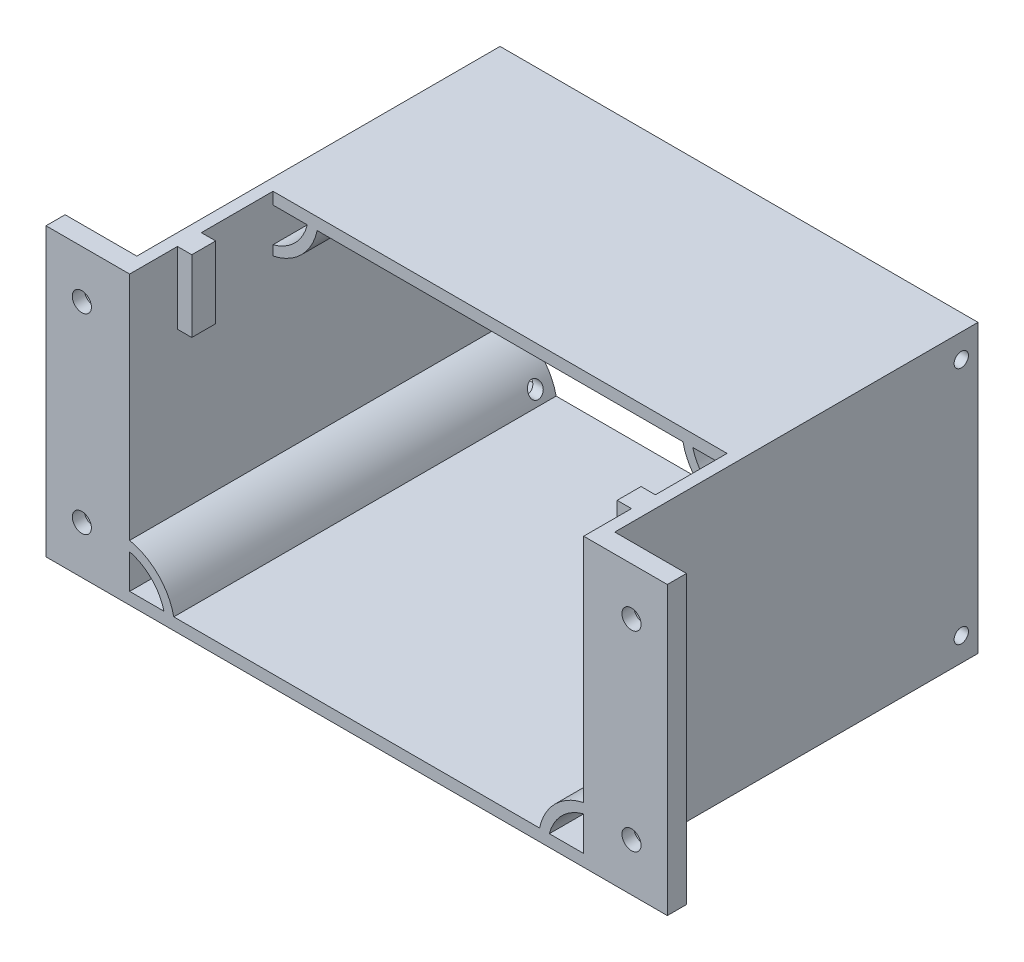
from build123d import *

# Parameters (mm, degrees)
SKETCH1_W                = 100
SKETCH1_H                = 60
BOSS_EXTRUDE1_DEPTH      = 150
SKETCH2_W                = 95
SKETCH2_H                = 30
CUT_EXTRUDE1_DEPTH       = 20
BOSS_EXTRUDE2_DEPTH      = 13
BOSS_EXTRUDE2_DEPTH_BACK = 5
SKETCH3_W                = 106
SKETCH3_H                = 66
SKETCH3_W_2              = 100
SKETCH3_H_2              = 60
SKETCH4_R                = 1.5
CUT_EXTRUDE2_DEPTH       = 120
SKETCH5_R                = 3
CUT_EXTRUDE3_DEPTH       = 1
CUT_EXTRUDE4_START       = -1
SKETCH6_R                = 3
CUT_EXTRUDE4_DEPTH       = 1
SKETCH8_W                = 157.221191822
SKETCH8_H                = 99.5531871
CUT_EXTRUDE6_DEPTH       = 83
SKETCH9_R                = 1.5
CUT_EXTRUDE7_DEPTH       = 120
SKETCH10_W               = 3
SKETCH10_H               = 5
BOSS_EXTRUDE3_DEPTH      = 15
SKETCH11_W               = 15
SKETCH11_H               = 60
SKETCH11_R               = 3
BOSS_EXTRUDE4_DEPTH      = 4
SKETCH11_3_R             = 3
SKETCH11_3_R_2           = 2
BOSS_EXTRUDE5_DEPTH      = 2.5


with BuildPart() as part:
    # Sketch1 → Boss-Extrude1 (new body)
    with BuildSketch(Plane.XY):
        with Locations((9.751655629, 0.960264901)):
            Rectangle(SKETCH1_W, SKETCH1_H)
        with BuildLine():
            Line((-37.748344371, 21.277806535), (-37.748344371, 28.460264901))
            Line((-37.748344371, 28.460264901), (-30.565886005, 28.460264901))
            ThreePointArc((-30.565886005, 28.460264901), (-33.177276559, 23.889197089), (-37.748344371, 21.277806535))
        make_face(mode=Mode.SUBTRACT)
        with BuildLine():
            Line((-37.748344371, -17.303040505), (-37.748344371, 19.223570306))
            ThreePointArc((-37.748344371, 19.223570306), (-31.763062997, 22.474983526), (-28.511649777, 28.460264901))
            Line((-28.511649777, 28.460264901), (48.014961035, 28.460264901))
            ThreePointArc((48.014961035, 28.460264901), (51.266374255, 22.474983526), (57.251655629, 19.223570306))
            Line((57.251655629, 19.223570306), (57.251655629, -17.303040505))
            ThreePointArc((57.251655629, -17.303040505), (51.266374255, -20.554453725), (48.014961035, -26.539735099))
            Line((48.014961035, -26.539735099), (-28.511649777, -26.539735099))
            ThreePointArc((-28.511649777, -26.539735099), (-31.763062997, -20.554453725), (-37.748344371, -17.303040505))
        make_face(mode=Mode.SUBTRACT)
        with BuildLine():
            Line((-37.748344371, -26.539735099), (-37.748344371, -19.357276734))
            ThreePointArc((-37.748344371, -19.357276734), (-33.177276559, -21.968667287), (-30.565886005, -26.539735099))
            Line((-30.565886005, -26.539735099), (-37.748344371, -26.539735099))
        make_face(mode=Mode.SUBTRACT)
        with BuildLine():
            Line((57.251655629, -26.539735099), (50.069197264, -26.539735099))
            ThreePointArc((50.069197264, -26.539735099), (52.680587817, -21.968667287), (57.251655629, -19.357276734))
            Line((57.251655629, -19.357276734), (57.251655629, -26.539735099))
        make_face(mode=Mode.SUBTRACT)
        with BuildLine():
            Line((57.251655629, 28.460264901), (57.251655629, 21.277806535))
            ThreePointArc((57.251655629, 21.277806535), (52.680587817, 23.889197089), (50.069197264, 28.460264901))
            Line((50.069197264, 28.460264901), (57.251655629, 28.460264901))
        make_face(mode=Mode.SUBTRACT)
    extrude(amount=BOSS_EXTRUDE1_DEPTH)

    # Sketch2 → Cut-Extrude1 (cut)
    with BuildSketch(Plane(origin=(0, 30.960264901, 0), x_dir=(1, 0, 0), z_dir=(0, 1, 0))):
        with Locations((9.751655629, -135)):
            Rectangle(SKETCH2_W, SKETCH2_H)
    extrude(amount=-CUT_EXTRUDE1_DEPTH, mode=Mode.SUBTRACT)

    # Sketch3 → Boss-Extrude2 (add, two sides: drawn at the far end of the back side and taken through both)
    with BuildSketch(Plane(origin=(0, 0, 0), x_dir=(-1, 0, 0), z_dir=(0, 0, -1)).offset(-BOSS_EXTRUDE2_DEPTH_BACK)):
        with Locations((-9.751655629, 0.960264901)):
            Rectangle(SKETCH3_W, SKETCH3_H)
        with Locations((-9.751655629, 0.960264901)):
            Rectangle(SKETCH3_W_2, SKETCH3_H_2, mode=Mode.SUBTRACT)
    extrude(amount=BOSS_EXTRUDE2_DEPTH + BOSS_EXTRUDE2_DEPTH_BACK)

    # Sketch4 → Cut-Extrude2 (cut)
    with BuildSketch(Plane.ZY.offset(43.248344371)):
        with Locations((-4, -24.039735099)):
            Circle(SKETCH4_R)
        with Locations((-4, 25.960264901)):
            Circle(SKETCH4_R)
    extrude(amount=-CUT_EXTRUDE2_DEPTH, mode=Mode.SUBTRACT)

    # Sketch5 → Cut-Extrude3 (cut)
    with BuildSketch(Plane(origin=(62.751655629, 0, 0), x_dir=(0, 0, -1), z_dir=(1, 0, 0))):
        with Locations((4, -24.039735099)):
            Circle(SKETCH5_R)
        with Locations((4, 25.960264901)):
            Circle(SKETCH5_R)
    extrude(amount=-CUT_EXTRUDE3_DEPTH, mode=Mode.SUBTRACT)

    # Sketch6 → Cut-Extrude4 (cut)
    with BuildSketch(Plane.ZY.offset(43.248344371).offset(CUT_EXTRUDE4_START)):
        with Locations((-4, 25.960264901)):
            Circle(SKETCH6_R)
        with Locations((-4, -24.087684502)):
            Circle(SKETCH6_R)
    extrude(amount=CUT_EXTRUDE4_DEPTH, mode=Mode.SUBTRACT)

    # Sketch8 → Cut-Extrude6 (cut)
    with BuildSketch(Plane(origin=(0, 0, -13), x_dir=(-1, 0, 0), z_dir=(0, 0, -1))):
        with Locations((-4.996574538, 1.162608777)):
            Rectangle(SKETCH8_W, SKETCH8_H)
    extrude(amount=-CUT_EXTRUDE6_DEPTH, mode=Mode.SUBTRACT)

    # Sketch9 → Cut-Extrude7 (cut)
    with BuildSketch(Plane(origin=(59.751655629, 0, 0), x_dir=(0, 0, -1), z_dir=(1, 0, 0))):
        with Locations((-73.5, -24.039735099)):
            Circle(SKETCH9_R)
        with Locations((-73.5, 25.960264901)):
            Circle(SKETCH9_R)
    extrude(amount=-CUT_EXTRUDE7_DEPTH, mode=Mode.SUBTRACT)

    # Sketch10 → Boss-Extrude3 (add)
    with BuildSketch(Plane(origin=(0, 30.960264901, 0), x_dir=(1, 0, 0), z_dir=(0, 1, 0))):
        with Locations((-36.248344371, -137.5)):
            Rectangle(SKETCH10_W, SKETCH10_H)
        with Locations((55.751655629, -137.5)):
            Rectangle(SKETCH10_W, SKETCH10_H)
    extrude(amount=-BOSS_EXTRUDE3_DEPTH)

    # Sketch11 → Boss-Extrude4 (add)
    # profile 1 of 2: a face of its own
    with BuildSketch(Plane.XY.offset(150)):
        with Locations((-47.748344371, 0.960264901)):
            Rectangle(SKETCH11_W, SKETCH11_H)
        with Locations((-47.748344371, -19.039735099)):
            Circle(SKETCH11_R, mode=Mode.SUBTRACT)
        with Locations((-47.748344371, 20.960264901)):
            Circle(SKETCH11_R, mode=Mode.SUBTRACT)
    # profile 2 of 2: a face of its own
    with BuildSketch(Plane.XY.offset(150)):
        with Locations((67.251655629, 0.960264901)):
            Rectangle(SKETCH11_W, SKETCH11_H)
        with Locations((67.251655629, -19.039735099)):
            Circle(SKETCH11_R, mode=Mode.SUBTRACT)
        with Locations((67.251655629, 20.960264901)):
            Circle(SKETCH11_R, mode=Mode.SUBTRACT)
    extrude(amount=-BOSS_EXTRUDE4_DEPTH)

    # Sketch11<3> → Boss-Extrude5 (add)
    # profile 1 of 4: a face of its own
    with BuildSketch(Plane.XY.offset(150)):
        with Locations((-47.748344371, -19.039735099)):
            Circle(SKETCH11_3_R)
        with Locations((-47.748344371, -19.039735099)):
            Circle(SKETCH11_3_R_2, mode=Mode.SUBTRACT)
    # profile 2 of 4: a face of its own
    with BuildSketch(Plane.XY.offset(150)):
        with Locations((67.251655629, 20.960264901)):
            Circle(SKETCH11_3_R)
        with Locations((67.251655629, 20.960264901)):
            Circle(SKETCH11_3_R_2, mode=Mode.SUBTRACT)
    # profile 3 of 4: a face of its own
    with BuildSketch(Plane.XY.offset(150)):
        with Locations((67.251655629, -19.039735099)):
            Circle(SKETCH11_3_R)
        with Locations((67.251655629, -19.039735099)):
            Circle(SKETCH11_3_R_2, mode=Mode.SUBTRACT)
    # profile 4 of 4: a face of its own
    with BuildSketch(Plane.XY.offset(150)):
        with Locations((-47.748344371, 20.960264901)):
            Circle(SKETCH11_3_R)
        with Locations((-47.748344371, 20.960264901)):
            Circle(SKETCH11_3_R_2, mode=Mode.SUBTRACT)
    extrude(amount=-BOSS_EXTRUDE5_DEPTH)


solid = part.part
